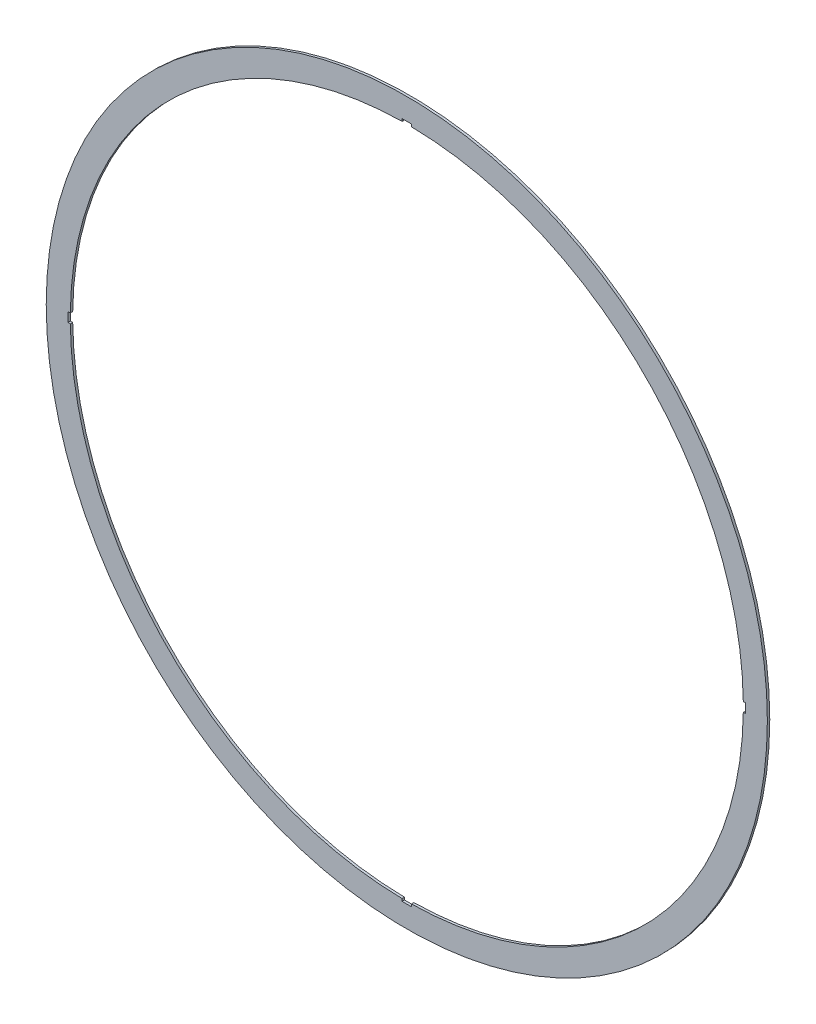
from build123d import *

# Parameters (mm, degrees)
SKETCH1_R           = 450
BOSS_EXTRUDE1_DEPTH = 3


with BuildPart() as part:
    # Sketch1 → Boss-Extrude1 (new body)
    with BuildSketch(Plane.XY):
        Circle(SKETCH1_R)
        with BuildLine():
            Line((423.000973547, 5.860465116), (419.959111044, 5.860465116))
            ThreePointArc((419.959111044, 5.860465116), (296.984848098, 296.984848098), (5.860465116, 419.959111044))
            Line((5.860465116, 419.959111044), (5.860465116, 423.000973547))
            Line((5.860465116, 423.000973547), (-5.860465116, 423.000973547))
            Line((-5.860465116, 423.000973547), (-5.860465116, 419.959111044))
            ThreePointArc((-5.860465116, 419.959111044), (-296.984848098, 296.984848098), (-419.959111044, 5.860465116))
            Line((-419.959111044, 5.860465116), (-423.000973547, 5.860465116))
            Line((-423.000973547, 5.860465116), (-423.000973547, -5.860465116))
            Line((-423.000973547, -5.860465116), (-419.959111044, -5.860465116))
            ThreePointArc((-419.959111044, -5.860465116), (-296.984848098, -296.984848098), (-5.860465116, -419.959111044))
            Line((-5.860465116, -419.959111044), (-5.860465116, -423.000973547))
            Line((-5.860465116, -423.000973547), (5.860465116, -423.000973547))
            Line((5.860465116, -423.000973547), (5.860465116, -419.959111044))
            ThreePointArc((5.860465116, -419.959111044), (296.984848098, -296.984848098), (419.959111044, -5.860465116))
            Line((419.959111044, -5.860465116), (423.000973547, -5.860465116))
            Line((423.000973547, -5.860465116), (423.000973547, 5.860465116))
        make_face(mode=Mode.SUBTRACT)
    extrude(amount=BOSS_EXTRUDE1_DEPTH)


solid = part.part
